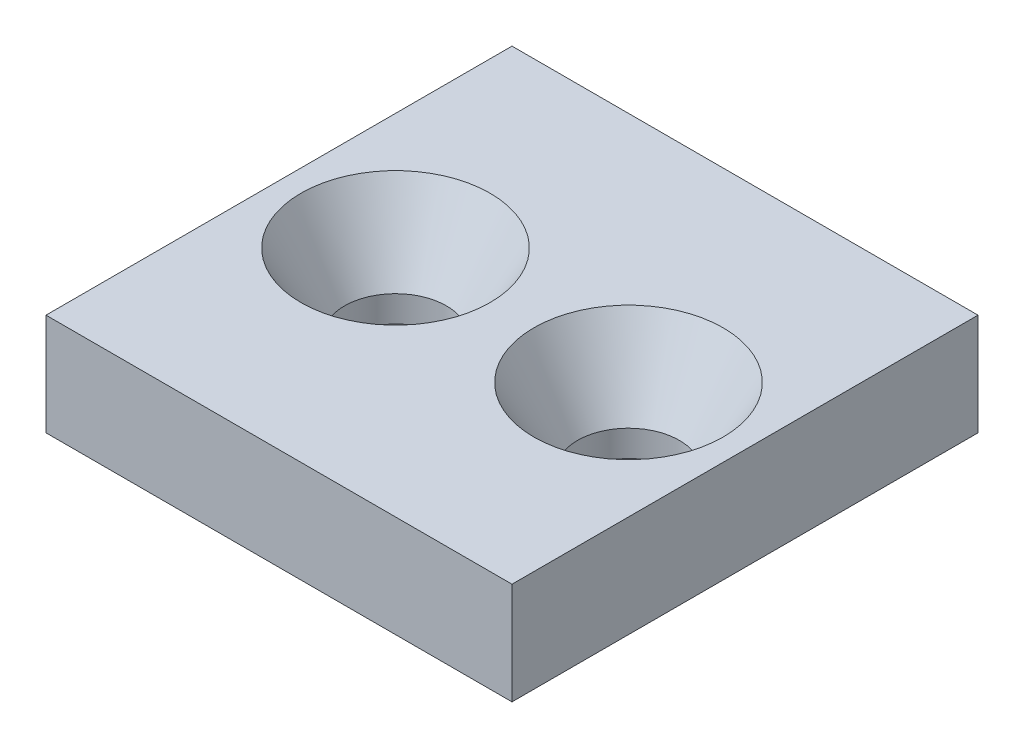
from build123d import *

# Parameters (mm, degrees)
SKETCH2_W                                      = 32
SKETCH2_H                                      = 32
BOSS_EXTRUDE1_DEPTH                            = 7
CSK_FOR_M6_FLAT_HEAD_MACHINE_SCREW1_AT_2_COUNT = 2
CSK_FOR_M6_FLAT_HEAD_MACHINE_SCREW1_AT_2_PITCH = 16


with BuildPart() as part:
    # Sketch2 → Boss-Extrude1 (new body)
    with BuildSketch(Plane(origin=(0, 0, 0), x_dir=(1, 0, 0), z_dir=(0, 1, 0))):
        Rectangle(SKETCH2_W, SKETCH2_H)
    extrude(amount=BOSS_EXTRUDE1_DEPTH)

    # Sketch6 → CSK for M6 Flat Head Machine Screw1 (revolve, cut)
    with BuildSketch(Plane(origin=(-8, 7, 0), x_dir=(0, 0, 1), z_dir=(1, 0, 0))):
        Polygon((0, 0), (0, 7), (3.5, 7), (3.5, 5.196152423), (6.5, 0), align=None)
    csk_for_m6_flat_head_machine_screw1 = revolve(axis=Axis((-8, 13.35, 0), (0, -1, 0)), mode=Mode.SUBTRACT)

    # CSK for M6 Flat Head Machine Screw1 at 2: CSK for M6 Flat Head Machine Screw1 ×2
    with Locations(*[(i * CSK_FOR_M6_FLAT_HEAD_MACHINE_SCREW1_AT_2_PITCH, 0, 0) for i in range(1, CSK_FOR_M6_FLAT_HEAD_MACHINE_SCREW1_AT_2_COUNT)]):
        add(csk_for_m6_flat_head_machine_screw1, mode=Mode.SUBTRACT)


solid = part.part
